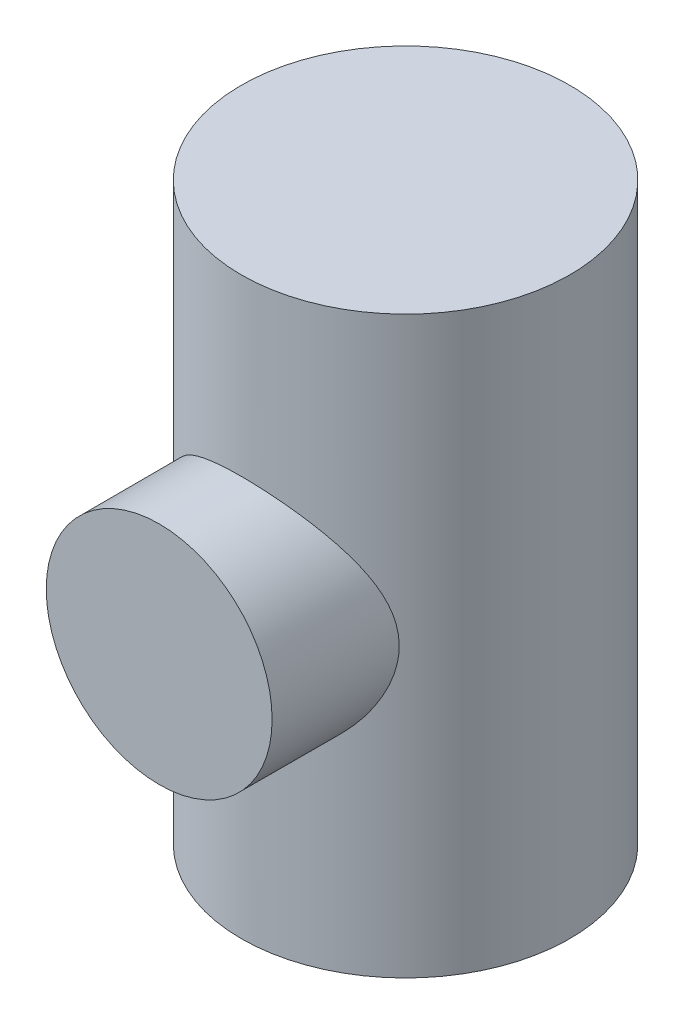
from build123d import *

# Parameters (mm, degrees)
SKETCH1_R           = 50.8
BOSS_EXTRUDE1_DEPTH = 88.9
SKETCH2_R           = 34.925
BOSS_EXTRUDE2_DEPTH = 76.2


with BuildPart() as part:
    # Sketch1 → Boss-Extrude1 (new, symmetric)
    with BuildSketch(Plane(origin=(0, 0, 0), x_dir=(1, 0, 0), z_dir=(0, 1, 0))):
        with Locations(Location((0, 0, 0), (0, 0, 270))):
            Circle(SKETCH1_R)
    extrude(amount=BOSS_EXTRUDE1_DEPTH, both=True)

    # Sketch2 → Boss-Extrude2 (add)
    with BuildSketch(Plane.XY):
        with Locations(Location((0, 0, 0), (0, 0, 180))):
            Circle(SKETCH2_R)
    extrude(amount=BOSS_EXTRUDE2_DEPTH)


solid = part.part
